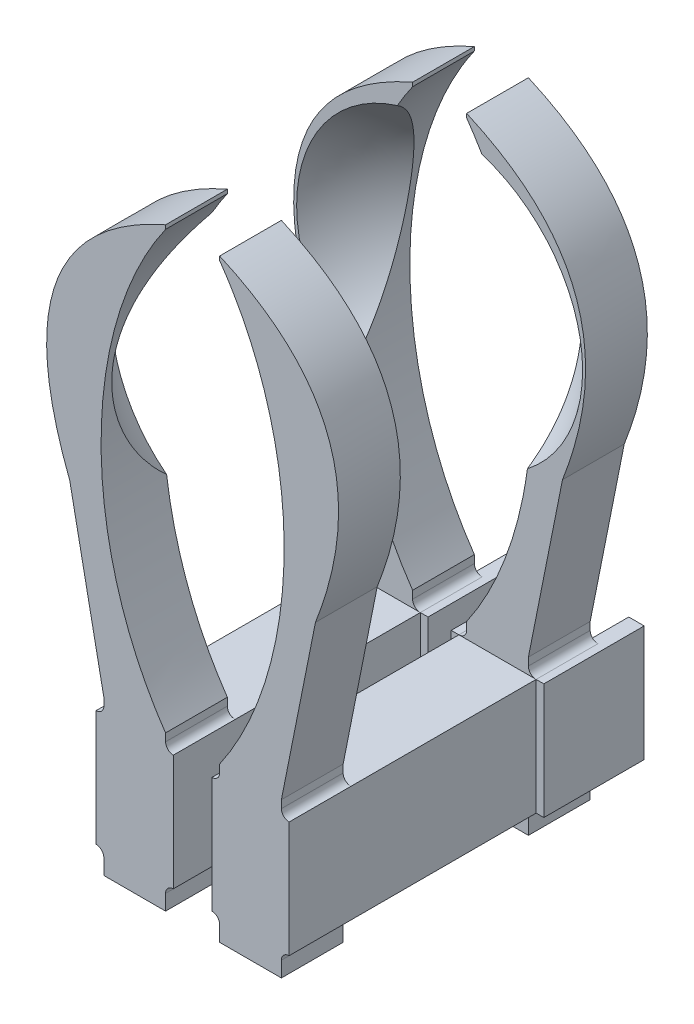
from build123d import *

# Parameters (mm, degrees)
SKETCH_1_R         = 2.3
EXTRUDE_1_DEPTH    = 8
EXTRUDE_1_2_DEPTH  = 8
SKETCH_2_W         = 8
SKETCH_2_H         = 15
EXTRUDE_2_DEPTH    = 2
SKETCH_3_W         = 2
SKETCH_3_H         = 15
EXTRUDE_3_DEPTH    = 5
SKETCH_4_W         = 8
SKETCH_4_H         = 15
EXTRUDE_4_DEPTH    = 2
SKETCH_5_W         = 2
SKETCH_5_H         = 15
EXTRUDE_5_DEPTH    = 5
FILLET_1_R         = 1
SKETCH_7_W         = 8
SKETCH_7_H         = 15
EXTRUDE_6_DEPTH    = 2
SKETCH_8_W         = 8
SKETCH_8_H         = 15
EXTRUDE_7_DEPTH    = 2
SKETCH_9_W         = 2
SKETCH_9_H         = 15
EXTRUDE_8_DEPTH    = 5
FILLET_2_R         = 1
EXTRUDE_10_DEPTH   = 8
EXTRUDE_10_2_DEPTH = 8
SKETCH_22_W        = 10
SKETCH_22_H        = 15
EXTRUDE_12_DEPTH   = 24


with BuildPart() as part:
    # 草图1 → 凸台-拉伸1 (new body)
    with BuildSketch(Plane.XY):
        with BuildLine():
            Line((-8, 0), (-8, 20))
            add(Edge.make_bspline(
                [(-8, 20), (2.997717423, 35.871381499), (3.288906564, 60.453592805), (-8, 76.491759263)],
                knots=[0, 0, 0, 0, 0.972662297, 0.972662297, 0.972662297, 0.972662297], degree=3))
            Line((-8, 76.491759263), (-8, 77))
            add(Edge.make_bspline(
                [(-8, 77), (14.198398274, 67.260824221), (4.413603164, 42.103141077)],
                knots=[0, 0, 0, 1, 1, 1], degree=2))
            Line((4.413603164, 42.103141077), (0, 20))
            Line((0, 20), (0, 0))
            Line((0, 0), (-8, 0))
        make_face()
        with Locations((-4, 10)):
            Circle(SKETCH_1_R, mode=Mode.SUBTRACT)
    extrude(amount=EXTRUDE_1_DEPTH)

    # 草图2 → 凸台-拉伸2 (add)
    with BuildSketch(Plane(origin=(0, 0, 0), x_dir=(0, 0, -1), z_dir=(1, 0, 0))):
        with Locations((-4, 10.5)):
            Rectangle(SKETCH_2_W, SKETCH_2_H)
    extrude(amount=EXTRUDE_2_DEPTH)

    # 草图3 → 凸台-拉伸3 (add)
    with BuildSketch(Plane(origin=(0, 0, 0), x_dir=(-1, 0, 0), z_dir=(0, 0, -1))):
        with Locations((-1, 10.5)):
            Rectangle(SKETCH_3_W, SKETCH_3_H)
    extrude(amount=EXTRUDE_3_DEPTH)

    # 草图4 → 凸台-拉伸4 (add)
    with BuildSketch(Plane.ZY.offset(8)):
        with Locations((4, 10.5)):
            Rectangle(SKETCH_4_W, SKETCH_4_H)
    extrude(amount=EXTRUDE_4_DEPTH)

    # 草图5 → 凸台-拉伸5 (add)
    with BuildSketch(Plane(origin=(0, 0, 0), x_dir=(-1, 0, 0), z_dir=(0, 0, -1))):
        with Locations((9, 10.5)):
            Rectangle(SKETCH_5_W, SKETCH_5_H)
    extrude(amount=EXTRUDE_5_DEPTH)

    # 圆角1
    fillet_1_edges = [part.edges().sort_by_distance(p)[0] for p in [
        (0, 3, 4),
        (0, 18, 4),
        (-8, 3, 4),
        (-8, 18, 4),
    ]]
    fillet(fillet_1_edges, radius=FILLET_1_R)


with BuildPart() as body_2:
    # 草图1 → Extrude 1 2 (new body)
    with BuildSketch(Plane.XY):
        with BuildLine():
            Line((-15, 77), (-15, 76.491759263))
            add(Edge.make_bspline(
                [(-15, 20), (-25.997717423, 35.871381499), (-26.288906564, 60.453592805), (-15, 76.491759263)],
                knots=[0, 0, 0, 0, 0.972662297, 0.972662297, 0.972662297, 0.972662297], degree=3))
            Line((-15, 20), (-15, 0))
            Line((-15, 0), (-23, 0))
            Line((-23, 0), (-23, 20))
            Line((-23, 20), (-27.413603164, 42.103141077))
            add(Edge.make_bspline(
                [(-15, 77), (-37.198398274, 67.260824221), (-27.413603164, 42.103141077)],
                knots=[0, 0, 0, 1, 1, 1], degree=2))
        make_face()
        with Locations(Location((-19, 10, 0), (0, 0, 180))):
            Circle(SKETCH_1_R, mode=Mode.SUBTRACT)
    extrude(amount=EXTRUDE_1_2_DEPTH)

    # 草图7 → 凸台-拉伸6 (add)
    with BuildSketch(Plane(origin=(-15, 0, 0), x_dir=(0, 0, -1), z_dir=(1, 0, 0))):
        with Locations((-4, 10.5)):
            Rectangle(SKETCH_7_W, SKETCH_7_H)
    extrude(amount=EXTRUDE_6_DEPTH)

    # 草图8 → 凸台-拉伸7 (add)
    with BuildSketch(Plane.ZY.offset(23)):
        with Locations((4, 10.5)):
            Rectangle(SKETCH_8_W, SKETCH_8_H)
    extrude(amount=EXTRUDE_7_DEPTH)

    # 草图9 → 凸台-拉伸8 (add)
    with BuildSketch(Plane(origin=(0, 0, 0), x_dir=(-1, 0, 0), z_dir=(0, 0, -1))):
        with Locations((14, 10.5)):
            Rectangle(SKETCH_9_W, SKETCH_9_H)
        with Locations((24, 10.5)):
            Rectangle(SKETCH_9_W, SKETCH_9_H)
    extrude(amount=EXTRUDE_8_DEPTH)

    # 圆角2
    fillet_2_edges = [body_2.edges().sort_by_distance(p)[0] for p in [
        (-15, 3, 4),
        (-15, 18, 4),
        (-23, 3, 4),
        (-23, 18, 4),
    ]]
    fillet(fillet_2_edges, radius=FILLET_2_R)


with BuildPart() as body_3:
    # 草图18 → 凸台-拉伸10 (new body)
    with BuildSketch(Plane(origin=(0, 0, 40), x_dir=(-1, 0, 0), z_dir=(0, 0, -1))):
        with BuildLine():
            Line((8, 19), (8, 20))
            add(Edge.make_bspline(
                [(8, 20), (-2.997717423, 35.871381499), (-3.288906564, 60.453592805), (8, 76.491759263)],
                knots=[0, 0, 0, 0, 0.972662297, 0.972662297, 0.972662297, 0.972662297], degree=3))
            Line((8, 76.491759263), (8, 77))
            add(Edge.make_bspline(
                [(8, 77), (-14.198398274, 67.260824221), (-4.413603164, 42.103141077)],
                knots=[0, 0, 0, 1, 1, 1], degree=2))
            Line((-4.413603164, 42.103141077), (0, 20))
            Line((0, 20), (0, 19))
            ThreePointArc((0, 19), (-0.292893219, 18.292893219), (-1, 18))
            Line((-1, 18), (-1, 3))
            ThreePointArc((-1, 3), (-0.292893219, 2.707106781), (0, 2))
            Line((0, 2), (0, 0))
            Line((0, 0), (8, 0))
            Line((8, 0), (8, 2))
            ThreePointArc((8, 2), (8.292893219, 2.707106781), (9, 3))
            Line((9, 3), (9, 18))
            ThreePointArc((9, 18), (8.292893219, 18.292893219), (8, 19))
        make_face()
    extrude(amount=EXTRUDE_10_DEPTH)


with BuildPart() as body_4:
    # 草图18 → Extrude 10 2 (new body)
    with BuildSketch(Plane(origin=(0, 0, 40), x_dir=(-1, 0, 0), z_dir=(0, 0, -1))):
        with BuildLine():
            Line((23, 0), (23, 2))
            ThreePointArc((23, 2), (23.292893219, 2.707106781), (24, 3))
            Line((24, 3), (24, 18))
            ThreePointArc((24, 18), (23.292893219, 18.292893219), (23, 19))
            Line((23, 19), (23, 20))
            Line((23, 20), (27.413603164, 42.103141077))
            add(Edge.make_bspline(
                [(27.413603164, 42.103141077), (37.198398274, 67.260824221), (15, 77)],
                knots=[0, 0, 0, 1, 1, 1], degree=2))
            Line((15, 77), (15, 76.491759263))
            add(Edge.make_bspline(
                [(15, 76.491759263), (26.288906564, 60.453592805), (25.997717423, 35.871381499), (15, 20)],
                knots=[0, 0, 0, 0, 0.972662297, 0.972662297, 0.972662297, 0.972662297], degree=3))
            Line((15, 20), (15, 19))
            ThreePointArc((15, 19), (14.707106781, 18.292893219), (14, 18))
            Line((14, 18), (14, 3))
            ThreePointArc((14, 3), (14.707106781, 2.707106781), (15, 2))
            Line((15, 2), (15, 0))
            Line((15, 0), (23, 0))
        make_face()
    extrude(amount=EXTRUDE_10_2_DEPTH)


with BuildPart() as cut_revolve_1_tool:
    # 草图13 → 切除-旋转1 (revolve)
    with BuildSketch(Plane(origin=(-11.5, 55.690543417, 8), x_dir=(1, 0, 0), z_dir=(0, 1, 0))):
        with BuildLine():
            Line((0, -33.432937933), (0, 10.26347139))
            ThreePointArc((0, 10.26347139), (-15.579514295, 3.732667985), (-21.84506009, -11.955403748))
            ThreePointArc((-21.84506009, -11.955403748), (-15.613678748, -27.705141018), (0, -34.27))
            Line((0, -34.27), (0, -33.432937933))
        make_face()
    revolve(axis=Axis((-11.5, 55.690543417, 1008), (0, 0, -1)))


with BuildPart() as part_1:
    add(part.part)

    # 切除-旋转1: cut by cut_revolve_1_tool
    add(cut_revolve_1_tool.part, mode=Mode.SUBTRACT)



with BuildPart() as body_2_1:
    add(body_2.part)

    # 切除-旋转1: cut by cut_revolve_1_tool
    add(cut_revolve_1_tool.part, mode=Mode.SUBTRACT)


with BuildPart() as body_3_1:
    add(body_3.part)

    # 切除-旋转1: cut by cut_revolve_1_tool
    add(cut_revolve_1_tool.part, mode=Mode.SUBTRACT)


with BuildPart() as body_4_1:
    add(body_4.part)

    # 切除-旋转1: cut by cut_revolve_1_tool
    add(cut_revolve_1_tool.part, mode=Mode.SUBTRACT)


with BuildPart() as part_2:
    add(part_1.part)

    add(body_2_1.part)  # 凸台-拉伸12 merges body 2

    add(body_3_1.part)  # 凸台-拉伸12 merges body 3

    add(body_4_1.part)  # 凸台-拉伸12 merges body 4
    # 草图22 → 凸台-拉伸12 (add)
    with BuildSketch(Plane(origin=(0, 0, 32), x_dir=(-1, 0, 0), z_dir=(0, 0, -1))):
        with Locations((19, 10.5)):
            Rectangle(SKETCH_22_W, SKETCH_22_H)
        with Locations((4, 10.5)):
            Rectangle(SKETCH_22_W, SKETCH_22_H)
    extrude(amount=EXTRUDE_12_DEPTH)


solid = part_2.part
